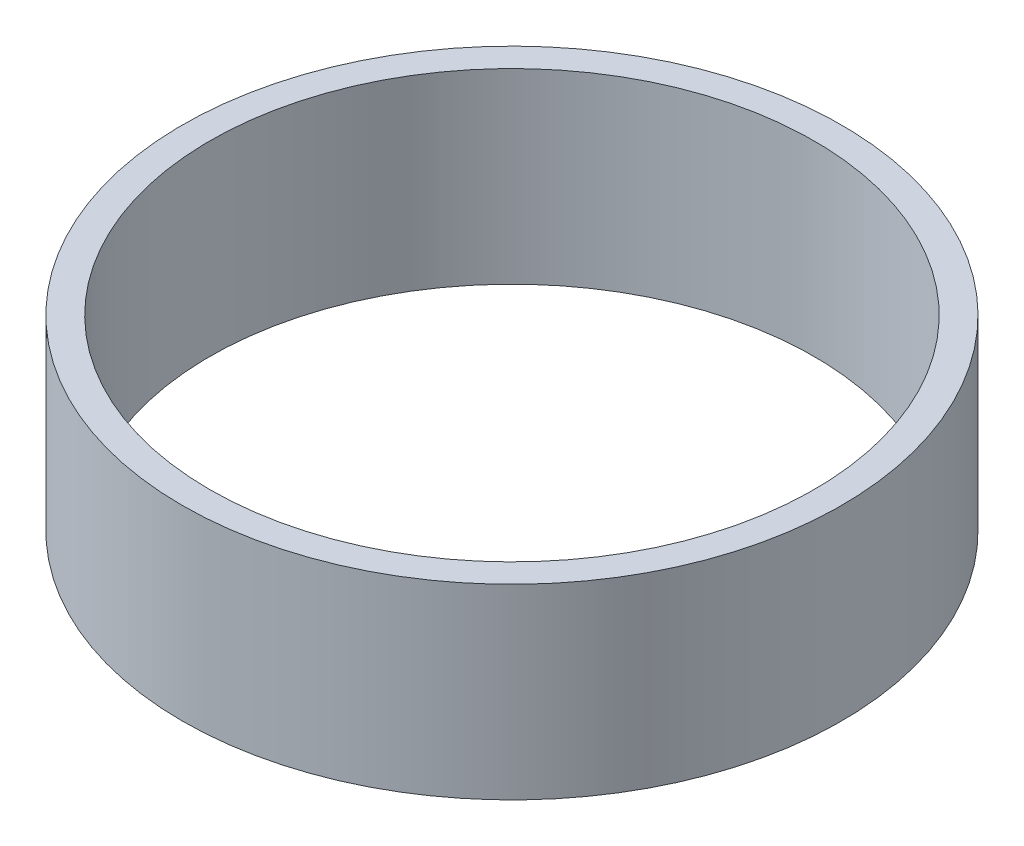
from build123d import *

# Parameters (mm, degrees)
SKETCH1_R           = 60
SKETCH1_R_2         = 55
BOSS_EXTRUDE1_DEPTH = 17


with BuildPart() as part:
    # Sketch1 → Boss-Extrude1 (new, symmetric)
    with BuildSketch(Plane(origin=(0, 0, 0), x_dir=(1, 0, 0), z_dir=(0, 1, 0))):
        with Locations(Location((0, 0, 0), (0, 0, 270))):
            Circle(SKETCH1_R)
        with Locations(Location((0, 0, 0), (0, 0, 270))):
            Circle(SKETCH1_R_2, mode=Mode.SUBTRACT)
    extrude(amount=BOSS_EXTRUDE1_DEPTH, both=True)


solid = part.part
